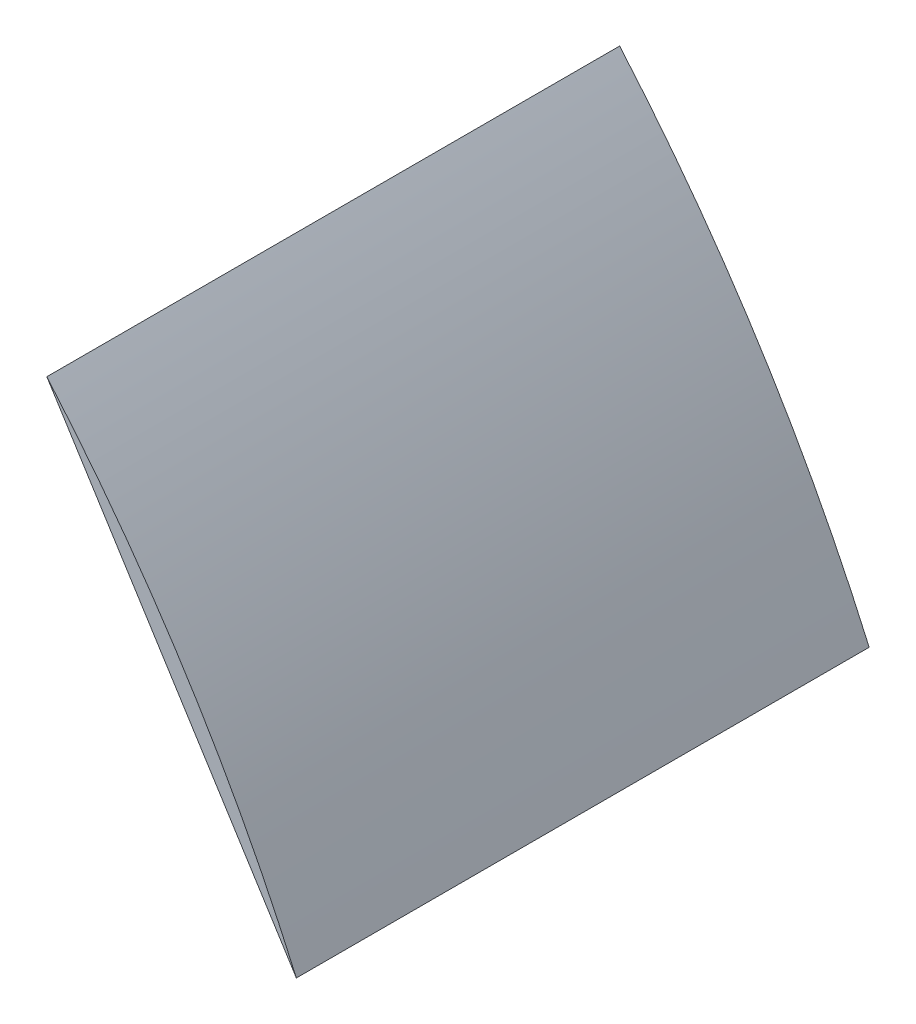
from build123d import *

# Parameters (mm, degrees)
CURVEBOSS_DEPTH = 7.139


with BuildPart() as part:
    # CurveSketch → CurveBoss (new body)
    with BuildSketch(Plane.XY):
        with BuildLine():
            Line((9.817481054, 26.590513407), (12.927307673, 21.655822369))
            ThreePointArc((12.927307673, 21.655822369), (11.555749808, 24.238717907), (9.817481054, 26.590513407))
        make_face()
    extrude(amount=CURVEBOSS_DEPTH)


solid = part.part
